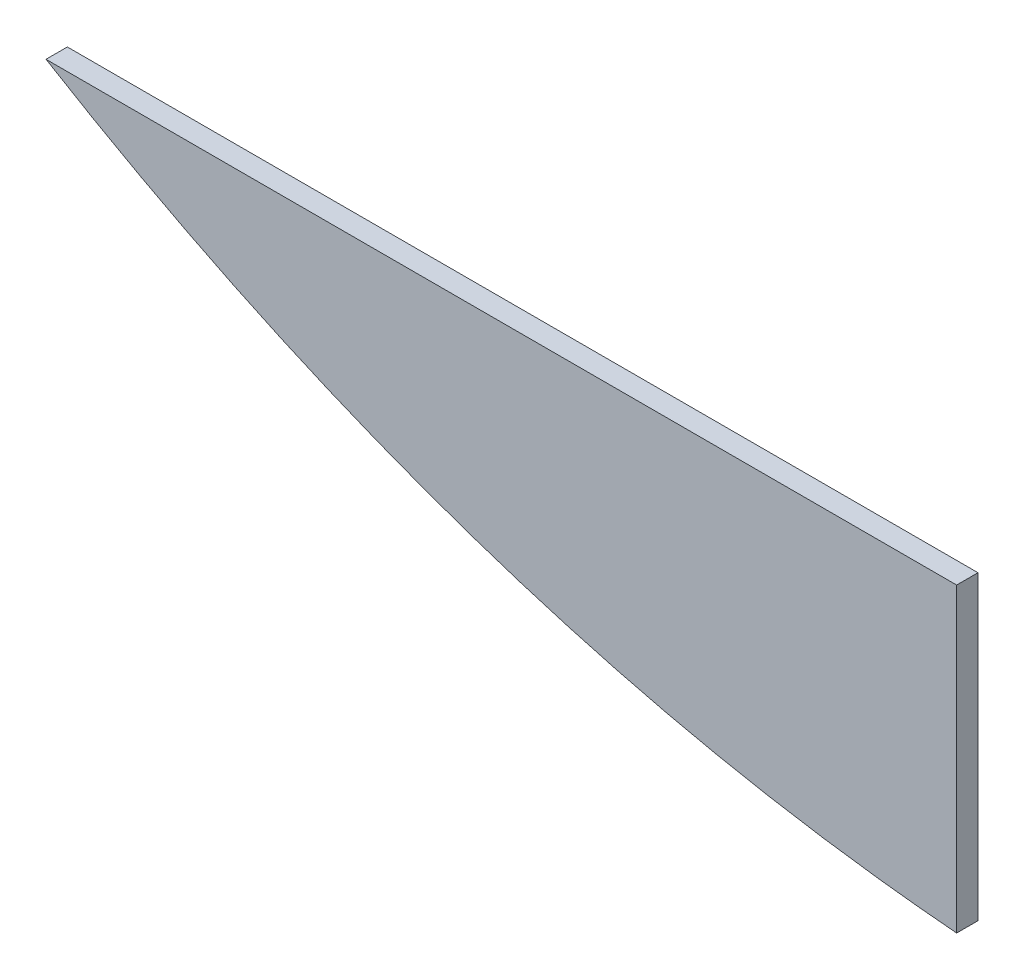
from build123d import *

# Parameters (mm, degrees)
BOSS_EXTRUDE1_DEPTH = 3.175


with BuildPart() as part:
    # Sketch1 → Boss-Extrude1 (new body)
    with BuildSketch(Plane.XY):
        with BuildLine():
            Line((67.70512505, 22.407623054), (-67.70512505, 22.407623054))
            add(Edge.make_bspline(
                [(67.70512505, -22.407623054), (-3.363591579, -16.464303642), (-67.70512505, 22.407623054)],
                knots=[0, 0, 0, 1, 1, 1], degree=2))
            Line((67.70512505, -22.407623054), (67.70512505, 22.407623054))
        make_face()
    extrude(amount=BOSS_EXTRUDE1_DEPTH)


solid = part.part
